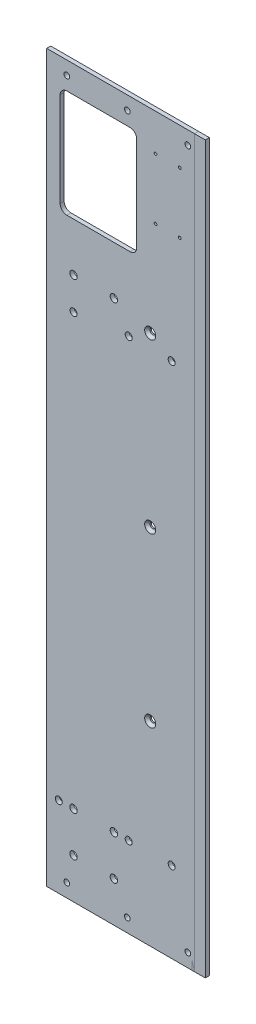
from build123d import *

# Parameters (mm, degrees)
SKETCH_1_W           = 150
SKETCH_1_H           = 540
EXTRUDE_1_DEPTH      = 3
SKETCH_2_R           = 2.1
SKETCH_2_R_2         = 1.6
CUT_EXTRUDE_1_DEPTH  = 281.239183556
CUT_EXTRUDE_2_REACH  = 282.239
SKETCH_4_R           = 2.1
CHAMFER_1_SIZE       = 2
CUT_EXTRUDE_4_REACH  = 282.239
SKETCH_6_R           = 2.6
CUT_EXTRUDE_5_REACH  = 282.239
SKETCH_7_R           = 2.75
CUT_EXTRUDE_6_REACH  = 282.239
SKETCH_8_R           = 2.75
SKETCH_9_R           = 2.75
CUT_EXTRUDE_7_DEPTH  = 10
CUT_EXTRUDE_START    = -10
SKETCH_10_W          = 25
SKETCH_10_H          = 80
SKETCH_10_R          = 1.6
SKETCH_10_W_2        = 7
CUT_EXTRUDE_8_DEPTH  = 10
FILLET_1_R           = 5
SKETCH_11_R          = 1
CUT_EXTRUDE_9_DEPTH  = 4
SKETCH_13_W          = 201.482983475
SKETCH_13_H          = 657.759334519
CUT_EXTRUDE_10_DEPTH = 10
SKETCH_14_W          = 10
SKETCH_14_H          = 540
EXTRUDE_2_DEPTH      = 3


with BuildPart() as part:
    # 草图1 → 凸台-拉伸1 (new body)
    with BuildSketch(Plane.XY):
        Rectangle(SKETCH_1_W, SKETCH_1_H)
    extrude(amount=EXTRUDE_1_DEPTH)

    # 草图2 → 切除-拉伸1 (cut, through all)
    with BuildSketch(Plane(origin=(0, 0, 0), x_dir=(-1, 0, 0), z_dir=(0, 0, -1))):
        with Locations((65, -260)):
            Circle(SKETCH_2_R)
        with Locations((-70, -260)):
            Circle(SKETCH_2_R)
        with Locations(Location((65, 260, 0), (0, 0, 180))):
            Circle(SKETCH_2_R)
        with Locations(Location((-70, 260, 0), (0, 0, 180))):
            Circle(SKETCH_2_R)
        with Locations((-25, -260)):
            Circle(SKETCH_2_R)
        with Locations((20, -260)):
            Circle(SKETCH_2_R)
        with Locations(Location((20, 260, 0), (0, 0, 180))):
            Circle(SKETCH_2_R)
        with Locations(Location((-25, 260, 0), (0, 0, 180))):
            Circle(SKETCH_2_R)
        with Locations((15, 196.5)):
            Circle(SKETCH_2_R_2)
        with Locations((15, 188.5)):
            Circle(SKETCH_2_R_2)
        with Locations(Location((-15, 196.5, 0), (0, 0, 180))):
            Circle(SKETCH_2_R_2)
        with Locations(Location((-15, 188.5, 0), (0, 0, 180))):
            Circle(SKETCH_2_R_2)
    extrude(amount=-CUT_EXTRUDE_1_DEPTH, mode=Mode.SUBTRACT)

    # 草图4 → 切除-拉伸2 (cut, up to next)
    with BuildSketch(Plane.XY.offset(3), mode=Mode.PRIVATE) as cut_extrude_2_sk1:
        with Locations((42, 125)):
            Circle(SKETCH_4_R)
    cut_extrude_2_tool1 = extrude(cut_extrude_2_sk1.sketch, amount=-CUT_EXTRUDE_2_REACH, mode=Mode.PRIVATE) & part.part
    # 草图4 → 切除-拉伸2 (cut, up to next)
    with BuildSketch(Plane.XY.offset(3), mode=Mode.PRIVATE) as cut_extrude_2_sk2:
        with Locations((42, -125)):
            Circle(SKETCH_4_R)
    cut_extrude_2_tool2 = extrude(cut_extrude_2_sk2.sketch, amount=-CUT_EXTRUDE_2_REACH, mode=Mode.PRIVATE) & part.part
    # 草图4 → 切除-拉伸2 (cut, up to next)
    with BuildSketch(Plane.XY.offset(3), mode=Mode.PRIVATE) as cut_extrude_2_sk3:
        with Locations((42, 0)):
            Circle(SKETCH_4_R)
    cut_extrude_2_tool3 = extrude(cut_extrude_2_sk3.sketch, amount=-CUT_EXTRUDE_2_REACH, mode=Mode.PRIVATE) & part.part
    # 草图4 → 切除-拉伸2 (cut, up to next)
    with BuildSketch(Plane.XY.offset(3), mode=Mode.PRIVATE) as cut_extrude_2_sk4:
        with Locations((-42, 0)):
            Circle(SKETCH_4_R)
    cut_extrude_2_tool4 = extrude(cut_extrude_2_sk4.sketch, amount=-CUT_EXTRUDE_2_REACH, mode=Mode.PRIVATE) & part.part
    # 草图4 → 切除-拉伸2 (cut, up to next)
    with BuildSketch(Plane.XY.offset(3), mode=Mode.PRIVATE) as cut_extrude_2_sk5:
        with Locations((-42, -125)):
            Circle(SKETCH_4_R)
    cut_extrude_2_tool5 = extrude(cut_extrude_2_sk5.sketch, amount=-CUT_EXTRUDE_2_REACH, mode=Mode.PRIVATE) & part.part
    # 草图4 → 切除-拉伸2 (cut, up to next)
    with BuildSketch(Plane.XY.offset(3), mode=Mode.PRIVATE) as cut_extrude_2_sk6:
        with Locations((-42, 125)):
            Circle(SKETCH_4_R)
    cut_extrude_2_tool6 = extrude(cut_extrude_2_sk6.sketch, amount=-CUT_EXTRUDE_2_REACH, mode=Mode.PRIVATE) & part.part
    add(cut_extrude_2_tool1.solids().sort_by_distance((42, 125, 3))[0], mode=Mode.SUBTRACT)
    add(cut_extrude_2_tool2.solids().sort_by_distance((42, -125, 3))[0], mode=Mode.SUBTRACT)
    add(cut_extrude_2_tool3.solids().sort_by_distance((42, 0, 3))[0], mode=Mode.SUBTRACT)
    add(cut_extrude_2_tool4.solids().sort_by_distance((-42, 0, 3))[0], mode=Mode.SUBTRACT)
    add(cut_extrude_2_tool5.solids().sort_by_distance((-42, -125, 3))[0], mode=Mode.SUBTRACT)
    add(cut_extrude_2_tool6.solids().sort_by_distance((-42, 125, 3))[0], mode=Mode.SUBTRACT)

    # 倒角1
    chamfer_1_edges = [part.edges().sort_by_distance(p)[0] for p in [
        (39.9, 0, 3),
        (39.9, -125, 3),
        (39.9, 125, 3),
    ]]
    chamfer(chamfer_1_edges, length=CHAMFER_1_SIZE)

    # 草图6 → 切除-拉伸4 (cut, up to next)
    with BuildSketch(Plane.XY.offset(3), mode=Mode.PRIVATE) as cut_extrude_4_sk1:
        with Locations((26, -210)):
            Circle(SKETCH_6_R)
    cut_extrude_4_tool1 = extrude(cut_extrude_4_sk1.sketch, amount=-CUT_EXTRUDE_4_REACH, mode=Mode.PRIVATE) & part.part
    # 草图6 → 切除-拉伸4 (cut, up to next)
    with BuildSketch(Plane.XY.offset(3), mode=Mode.PRIVATE) as cut_extrude_4_sk2:
        with Locations((-26, -210)):
            Circle(SKETCH_6_R)
    cut_extrude_4_tool2 = extrude(cut_extrude_4_sk2.sketch, amount=-CUT_EXTRUDE_4_REACH, mode=Mode.PRIVATE) & part.part
    # 草图6 → 切除-拉伸4 (cut, up to next)
    with BuildSketch(Plane.XY.offset(3), mode=Mode.PRIVATE) as cut_extrude_4_sk3:
        with Locations((58, -210)):
            Circle(SKETCH_6_R)
    cut_extrude_4_tool3 = extrude(cut_extrude_4_sk3.sketch, amount=-CUT_EXTRUDE_4_REACH, mode=Mode.PRIVATE) & part.part
    # 草图6 → 切除-拉伸4 (cut, up to next)
    with BuildSketch(Plane.XY.offset(3), mode=Mode.PRIVATE) as cut_extrude_4_sk4:
        with Locations((-58, -210)):
            Circle(SKETCH_6_R)
    cut_extrude_4_tool4 = extrude(cut_extrude_4_sk4.sketch, amount=-CUT_EXTRUDE_4_REACH, mode=Mode.PRIVATE) & part.part
    # 草图6 → 切除-拉伸4 (cut, up to next)
    with BuildSketch(Plane.XY.offset(3), mode=Mode.PRIVATE) as cut_extrude_4_sk5:
        with Locations((-47, 110)):
            Circle(SKETCH_6_R)
    cut_extrude_4_tool5 = extrude(cut_extrude_4_sk5.sketch, amount=-CUT_EXTRUDE_4_REACH, mode=Mode.PRIVATE) & part.part
    # 草图6 → 切除-拉伸4 (cut, up to next)
    with BuildSketch(Plane.XY.offset(3), mode=Mode.PRIVATE) as cut_extrude_4_sk6:
        with Locations((-15, 110)):
            Circle(SKETCH_6_R)
    cut_extrude_4_tool6 = extrude(cut_extrude_4_sk6.sketch, amount=-CUT_EXTRUDE_4_REACH, mode=Mode.PRIVATE) & part.part
    # 草图6 → 切除-拉伸4 (cut, up to next)
    with BuildSketch(Plane.XY.offset(3), mode=Mode.PRIVATE) as cut_extrude_4_sk7:
        with Locations((26, 115)):
            Circle(SKETCH_6_R)
    cut_extrude_4_tool7 = extrude(cut_extrude_4_sk7.sketch, amount=-CUT_EXTRUDE_4_REACH, mode=Mode.PRIVATE) & part.part
    # 草图6 → 切除-拉伸4 (cut, up to next)
    with BuildSketch(Plane.XY.offset(3), mode=Mode.PRIVATE) as cut_extrude_4_sk8:
        with Locations((58, 115)):
            Circle(SKETCH_6_R)
    cut_extrude_4_tool8 = extrude(cut_extrude_4_sk8.sketch, amount=-CUT_EXTRUDE_4_REACH, mode=Mode.PRIVATE) & part.part
    add(cut_extrude_4_tool1.solids().sort_by_distance((26, -210, 3))[0], mode=Mode.SUBTRACT)
    add(cut_extrude_4_tool2.solids().sort_by_distance((-26, -210, 3))[0], mode=Mode.SUBTRACT)
    add(cut_extrude_4_tool3.solids().sort_by_distance((58, -210, 3))[0], mode=Mode.SUBTRACT)
    add(cut_extrude_4_tool4.solids().sort_by_distance((-58, -210, 3))[0], mode=Mode.SUBTRACT)
    add(cut_extrude_4_tool5.solids().sort_by_distance((-47, 110, 3))[0], mode=Mode.SUBTRACT)
    add(cut_extrude_4_tool6.solids().sort_by_distance((-15, 110, 3))[0], mode=Mode.SUBTRACT)
    add(cut_extrude_4_tool7.solids().sort_by_distance((26, 115, 3))[0], mode=Mode.SUBTRACT)
    add(cut_extrude_4_tool8.solids().sort_by_distance((58, 115, 3))[0], mode=Mode.SUBTRACT)

    # 草图7 → 切除-拉伸5 (cut, up to next)
    with BuildSketch(Plane.XY.offset(3), mode=Mode.PRIVATE) as cut_extrude_5_sk1:
        with Locations((-15, 134)):
            Circle(SKETCH_7_R)
    cut_extrude_5_tool1 = extrude(cut_extrude_5_sk1.sketch, amount=-CUT_EXTRUDE_5_REACH, mode=Mode.PRIVATE) & part.part
    # 草图7 → 切除-拉伸5 (cut, up to next)
    with BuildSketch(Plane.XY.offset(3), mode=Mode.PRIVATE) as cut_extrude_5_sk2:
        with Locations((15, 134)):
            Circle(SKETCH_7_R)
    cut_extrude_5_tool2 = extrude(cut_extrude_5_sk2.sketch, amount=-CUT_EXTRUDE_5_REACH, mode=Mode.PRIVATE) & part.part
    add(cut_extrude_5_tool1.solids().sort_by_distance((-15, 134, 3))[0], mode=Mode.SUBTRACT)
    add(cut_extrude_5_tool2.solids().sort_by_distance((15, 134, 3))[0], mode=Mode.SUBTRACT)

    # 草图8 → 切除-拉伸6 (cut, up to next)
    with BuildSketch(Plane.XY.offset(3), mode=Mode.PRIVATE) as cut_extrude_6_sk1:
        with Locations((-15, -210)):
            Circle(SKETCH_8_R)
    cut_extrude_6_tool1 = extrude(cut_extrude_6_sk1.sketch, amount=-CUT_EXTRUDE_6_REACH, mode=Mode.PRIVATE) & part.part
    # 草图8 → 切除-拉伸6 (cut, up to next)
    with BuildSketch(Plane.XY.offset(3), mode=Mode.PRIVATE) as cut_extrude_6_sk2:
        with Locations((15, -210)):
            Circle(SKETCH_8_R)
    cut_extrude_6_tool2 = extrude(cut_extrude_6_sk2.sketch, amount=-CUT_EXTRUDE_6_REACH, mode=Mode.PRIVATE) & part.part
    add(cut_extrude_6_tool1.solids().sort_by_distance((-15, -210, 3))[0], mode=Mode.SUBTRACT)
    add(cut_extrude_6_tool2.solids().sort_by_distance((15, -210, 3))[0], mode=Mode.SUBTRACT)

    # 草图9 → 切除-拉伸7 (cut)
    with BuildSketch(Plane.XY.offset(3)):
        with Locations((-15, -240)):
            Circle(SKETCH_9_R)
        with Locations(Location((15, -240, 0), (0, 0, 180))):
            Circle(SKETCH_9_R)
    extrude(amount=-CUT_EXTRUDE_7_DEPTH, mode=Mode.SUBTRACT)

    # 草图10 → 切除-拉伸8 (cut)
    # profile 1 of 3: a face of its own
    with BuildSketch(Plane.XY.offset(3).offset(CUT_EXTRUDE_START)):
        with Locations((-12.5, 210)):
            Rectangle(SKETCH_10_W, SKETCH_10_H)
        with Locations((-15, 188.5)):
            Circle(SKETCH_10_R, mode=Mode.SUBTRACT)
        with Locations((-15, 196.5)):
            Circle(SKETCH_10_R, mode=Mode.SUBTRACT)
    # profile 2 of 3: a face of its own
    with BuildSketch(Plane.XY.offset(3).offset(CUT_EXTRUDE_START)):
        with Locations((12.5, 210)):
            Rectangle(SKETCH_10_W, SKETCH_10_H)
        with Locations((15, 188.5)):
            Circle(SKETCH_10_R, mode=Mode.SUBTRACT)
        with Locations((15, 196.5)):
            Circle(SKETCH_10_R, mode=Mode.SUBTRACT)
    # profile 3 of 3: a face of its own
    with BuildSketch(Plane.XY.offset(3).offset(CUT_EXTRUDE_START)):
        with Locations((28.5, 210)):
            Rectangle(SKETCH_10_W_2, SKETCH_10_H)
    extrude(amount=CUT_EXTRUDE_8_DEPTH, mode=Mode.SUBTRACT)

    # 圆角1
    fillet_1_edges = [part.edges().sort_by_distance(p)[0] for p in [
        (-25, 250, 1.5),
        (32, 250, 1.5),
        (32, 170, 1.5),
        (-25, 170, 1.5),
    ]]
    fillet(fillet_1_edges, radius=FILLET_1_R)

    # 草图11 → 切除-拉伸9 (cut)
    with BuildSketch(Plane.XY.offset(3)):
        with Locations((46, 242.6)):
            Circle(SKETCH_11_R)
        with Locations(Location((64, 242.6, 0), (0, 0, 180))):
            Circle(SKETCH_11_R)
        with Locations((64, 197.4)):
            Circle(SKETCH_11_R)
        with Locations(Location((46, 197.4, 0), (0, 0, 180))):
            Circle(SKETCH_11_R)
    extrude(amount=-CUT_EXTRUDE_9_DEPTH, mode=Mode.SUBTRACT)

    # 草图13 → 切除-拉伸10 (cut)
    with BuildSketch(Plane.XY.offset(3)):
        with Locations((-135.741491738, -58.87966726)):
            Rectangle(SKETCH_13_W, SKETCH_13_H)
    extrude(amount=-CUT_EXTRUDE_10_DEPTH, mode=Mode.SUBTRACT)


with BuildPart() as body_2:
    # 草图14 → 凸台-拉伸2 (new body)
    with BuildSketch(Plane.XY.offset(3)):
        with Locations((78, 0)):
            Rectangle(SKETCH_14_W, SKETCH_14_H)
    extrude(amount=-EXTRUDE_2_DEPTH)


solid = Compound([part.part, body_2.part])
